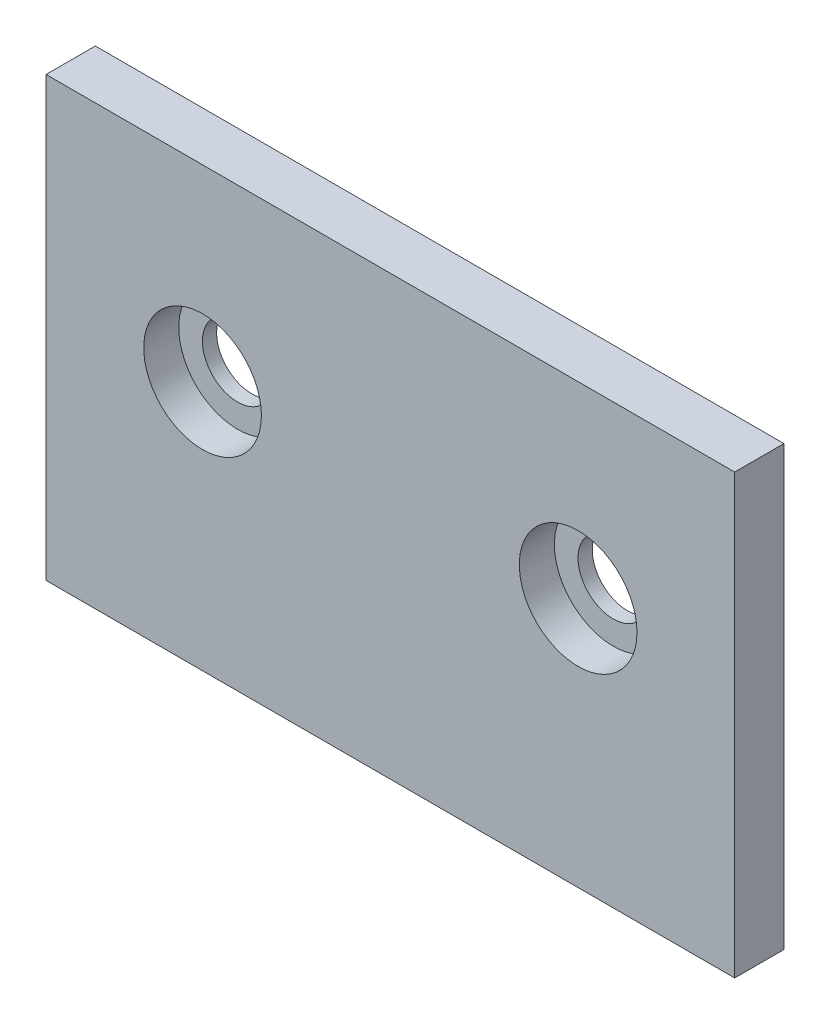
from build123d import *

# Parameters (mm, degrees)
CROQUIS1_W                                           = 69.85
CROQUIS1_H                                           = 44.45
SALIENTE_EXTRUIR1_DEPTH                              = 5
REFRENTADO_PARA_TORNILLO_CON_CABEZA_HUEC_D           = 7.14248
REFRENTADO_PARA_TORNILLO_CON_CABEZA_HUEC_DEPTH       = 24
REFRENTADO_PARA_TORNILLO_CON_CABEZA_HUEC_CBORE_D     = 11.938
REFRENTADO_PARA_TORNILLO_CON_CABEZA_HUEC_CBORE_DEPTH = 3.556
REFRENTADO_PARA_TORNILLO_CON_CABEZA_HUEC_TIP         = 2.145817477


with BuildPart() as part:
    # Croquis1 → Saliente-Extruir1 (new body)
    with BuildSketch(Plane.XY):
        Rectangle(CROQUIS1_W, CROQUIS1_H)
    extrude(amount=-SALIENTE_EXTRUIR1_DEPTH)

    # Refrentado para tornillo con cabeza hueca de 1/42
    with Locations(Plane.XY):
        with Locations((-19.05, 3.175), (19.05, 3.175)):
            CounterBoreHole(REFRENTADO_PARA_TORNILLO_CON_CABEZA_HUEC_D / 2, REFRENTADO_PARA_TORNILLO_CON_CABEZA_HUEC_CBORE_D / 2, REFRENTADO_PARA_TORNILLO_CON_CABEZA_HUEC_CBORE_DEPTH, depth=REFRENTADO_PARA_TORNILLO_CON_CABEZA_HUEC_DEPTH)
            with Locations((0, 0, -(REFRENTADO_PARA_TORNILLO_CON_CABEZA_HUEC_DEPTH + REFRENTADO_PARA_TORNILLO_CON_CABEZA_HUEC_TIP / 2))):  # 118° drill point
                Cone(0, REFRENTADO_PARA_TORNILLO_CON_CABEZA_HUEC_D / 2, REFRENTADO_PARA_TORNILLO_CON_CABEZA_HUEC_TIP, mode=Mode.SUBTRACT)


solid = part.part
